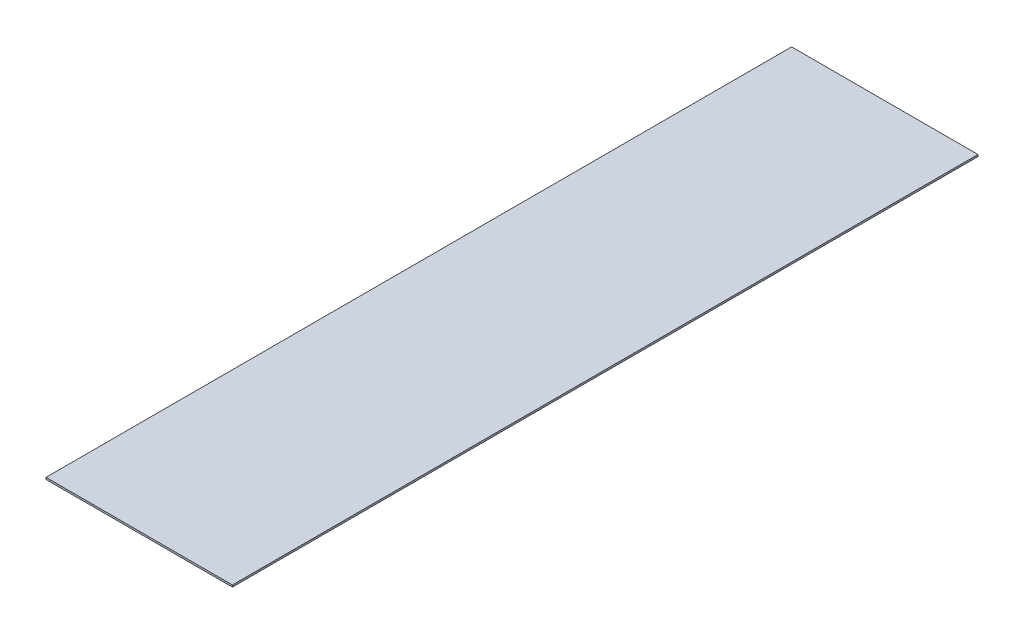
from build123d import *

# Parameters (mm, degrees)
SKETCH_1_W      = 400
SKETCH_1_H      = 1600
EXTRUDE_1_DEPTH = 4


with BuildPart() as part:
    # 草图1 → 凸台-拉伸1 (new body)
    with BuildSketch(Plane(origin=(0, 0, 0), x_dir=(1, 0, 0), z_dir=(0, 1, 0))):
        with Locations((-200, 800)):
            Rectangle(SKETCH_1_W, SKETCH_1_H)
    extrude(amount=EXTRUDE_1_DEPTH)


solid = part.part
